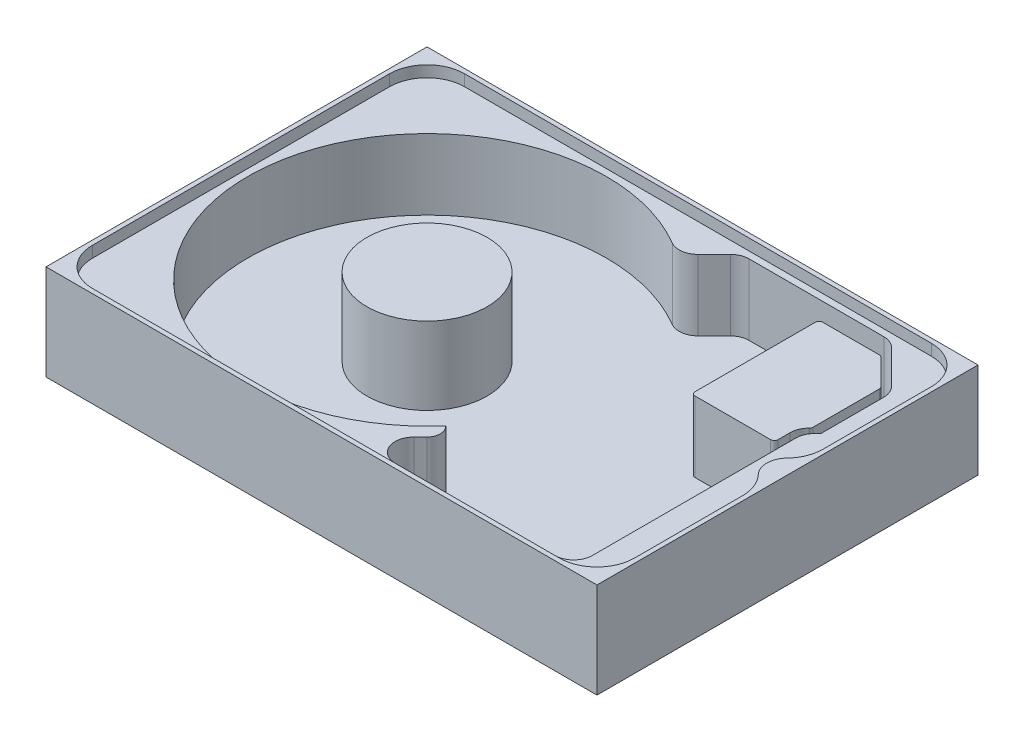
from build123d import *

# Parameters (mm, degrees)
SKETCH1_W           = 146.65
SKETCH1_H           = 101.42
BOSS_EXTRUDE1_DEPTH = 25.4
CUT_EXTRUDE1_DEPTH  = 3
FILLET1_R           = 10
SKETCH3_R           = 47.7
CUT_EXTRUDE2_DEPTH  = 18.8
FILLET2_R           = 5
SKETCH4_R           = 16
BOSS_EXTRUDE2_DEPTH = 20.6
BOSS_EXTRUDE3_DEPTH = 18.8
FILLET4_R           = 1
FILLET5_R           = 5


with BuildPart() as part:
    # Sketch1 → Boss-Extrude1 (new body)
    with BuildSketch(Plane(origin=(0, 0, 0), x_dir=(1, 0, 0), z_dir=(0, 1, 0))):
        Rectangle(SKETCH1_W, SKETCH1_H)
    extrude(amount=BOSS_EXTRUDE1_DEPTH)

    # Sketch2 → Cut-Extrude1 (cut)
    with BuildSketch(Plane(origin=(0, 25.4, 0), x_dir=(1, 0, 0), z_dir=(0, 1, 0))):
        with BuildLine():
            Line((-72.125, 49.51), (-72.125, -49.51))
            Line((-72.125, -49.51), (72.125, -49.51))
            Line((72.125, -49.51), (72.125, -5.36749476))
            ThreePointArc((72.125, -5.36749476), (67.825, 0), (72.125, 5.36749476))
            Line((72.125, 5.36749476), (72.125, 49.51))
            Line((72.125, 49.51), (-72.125, 49.51))
        make_face()
    extrude(amount=-CUT_EXTRUDE1_DEPTH, mode=Mode.SUBTRACT)

    # Fillet1
    fillet1_edges = [part.edges().sort_by_distance(p)[0] for p in [
        (72.125, 23.9, -5.36749476),
        (72.125, 23.9, 5.36749476),
        (72.125, 23.9, 49.51),
        (-72.125, 23.9, 49.51),
        (-72.125, 23.9, -49.51),
        (72.125, 23.9, -49.51),
    ]]
    fillet(fillet1_edges, radius=FILLET1_R)

    # Sketch3 → Cut-Extrude2 (cut)
    with BuildSketch(Plane(origin=(0, 22.4, 0), x_dir=(1, 0, 0), z_dir=(0, 1, 0))):
        with BuildLine():
            Line((3.325, -46.51), (62.925, -46.51))
            Line((62.925, -46.51), (62.925, 14.7))
            Line((62.925, 14.7), (65.225, 17))
            Line((65.225, 17), (65.225, 35.8))
            Line((65.225, 35.8), (53.325, 47.7))
            Line((53.325, 47.7), (13.325, 47.7))
            Line((13.325, 47.7), (4.71750668, 39.09250668))
            ThreePointArc((4.71750668, 39.09250668), (19.687781047, 22.040070682), (25.085, 0))
            ThreePointArc((25.085, 0), (22.099291128, -16.610905119), (13.515936315, -31.142341611))
            ThreePointArc((13.515936315, -31.142341611), (14.64327542, -33.663677787), (13.61, -36.225))
            Line((13.61, -36.225), (3.325, -46.51))
        make_face()
        with Locations((-22.615, 0)):
            Circle(SKETCH3_R)
    extrude(amount=-CUT_EXTRUDE2_DEPTH, mode=Mode.SUBTRACT)

    # Fillet2
    fillet2_edges = [part.edges().sort_by_distance(p)[0] for p in [
        (4.71750668, 13, -39.09250668),
        (13.325, 13, -47.7),
        (53.325, 13, -47.7),
        (65.225, 13, -35.8),
        (62.925, 13, -14.7),
        (62.925, 13, 46.51),
        (3.325, 13, 46.51),
    ]]
    fillet(fillet2_edges, radius=FILLET2_R)

    # Sketch4 → Boss-Extrude2 (add)
    with BuildSketch(Plane(origin=(0, 3.6, 0), x_dir=(1, 0, 0), z_dir=(0, 1, 0))):
        with Locations(Location((-22.615, 0, 0), (0, 0, 90))):
            Circle(SKETCH4_R)
    extrude(amount=BOSS_EXTRUDE2_DEPTH)

    # Sketch5 → Boss-Extrude3 (add)
    with BuildSketch(Plane(origin=(0, 3.6, 0), x_dir=(1, 0, 0), z_dir=(0, 1, 0))):
        Polygon((38.825, 42.9), (55.296572875, 42.9), (62.725, 35.471572875), (62.725, 17), (60.925, 15.2), (60.925, 8.9), (38.825, 8.9), align=None)
    extrude(amount=BOSS_EXTRUDE3_DEPTH)

    # Fillet4
    fillet4_edges = [part.edges().sort_by_distance(p)[0] for p in [
        (38.825, 13, -42.9),
        (38.825, 13, -8.9),
        (60.925, 13, -8.9),
        (62.725, 13, -17),
        (62.725, 13, -35.471572875),
        (55.296572875, 13, -42.9),
    ]]
    fillet(fillet4_edges, radius=FILLET4_R)

    # Fillet5
    fillet5_edges = [part.edges().sort_by_distance(p)[0] for p in [
        (60.925, 13, -15.2),
    ]]
    fillet(fillet5_edges, radius=FILLET5_R)


solid = part.part
